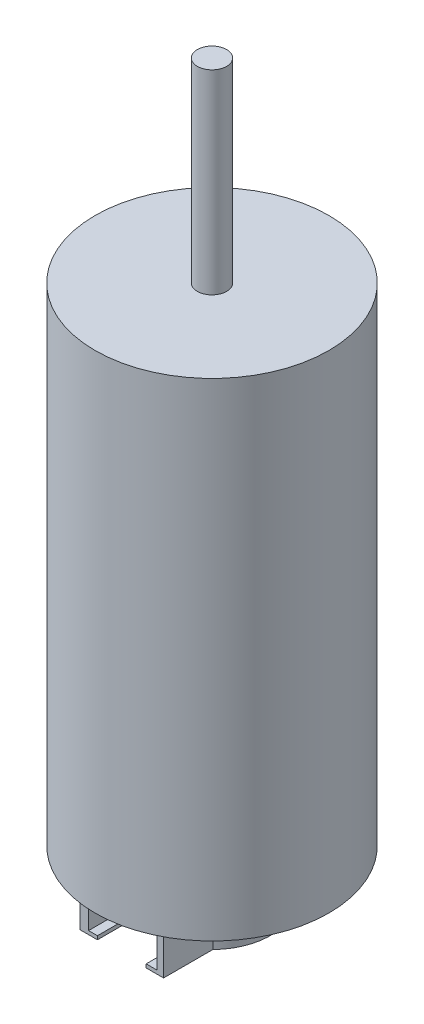
from build123d import *

# Parameters (mm, degrees)
SKETCH1_R           = 12
BOSS_EXTRUDE1_DEPTH = 50
SKETCH2_R           = 1.5
BOSS_EXTRUDE2_DEPTH = 20
BOSS_EXTRUDE3_DEPTH = 5
SKETCH4_W           = 7
SKETCH4_H           = 4
CUT_EXTRUDE1_DEPTH  = 5
SKETCH5_W           = 5
SKETCH5_H           = 3.450611601
CUT_EXTRUDE2_DEPTH  = 0.4


with BuildPart() as part:
    # Sketch1 → Boss-Extrude1 (new body)
    with BuildSketch(Plane(origin=(0, 0, 0), x_dir=(1, 0, 0), z_dir=(0, 1, 0))):
        with Locations(Location((0, 0, 0), (0, 0, 270))):
            Circle(SKETCH1_R)
    extrude(amount=BOSS_EXTRUDE1_DEPTH)

    # Sketch2 → Boss-Extrude2 (add)
    with BuildSketch(Plane(origin=(0, 50, 0), x_dir=(1, 0, 0), z_dir=(0, 1, 0))):
        with Locations(Location((0, 0, 0), (0, 0, 270))):
            Circle(SKETCH2_R)
    extrude(amount=BOSS_EXTRUDE2_DEPTH)

    # Sketch3 → Boss-Extrude3 (add)
    with BuildSketch(Plane.XZ):
        with BuildLine():
            Line((-4.284272991, 4.200595784), (-4.284272991, 9.25435285))
            Line((-4.284272991, 9.25435285), (4.284272991, 9.25435285))
            Line((4.284272991, 9.25435285), (4.284272991, 4.200595784))
            ThreePointArc((4.284272991, 4.200595784), (0, -6), (-4.284272991, 4.200595784))
        make_face()
    extrude(amount=BOSS_EXTRUDE3_DEPTH)

    # Sketch4 → Cut-Extrude1 (cut)
    with BuildSketch(Plane.XY.offset(9.25435285)):
        with Locations((0.08918727, -2.633127674)):
            Rectangle(SKETCH4_W, SKETCH4_H)
    extrude(amount=-CUT_EXTRUDE1_DEPTH, mode=Mode.SUBTRACT)

    # Sketch5 → Cut-Extrude2 (cut)
    with BuildSketch(Plane.XZ.offset(5)):
        with Locations((-0.001847359, 7.52904705)):
            Rectangle(SKETCH5_W, SKETCH5_H)
    extrude(amount=-CUT_EXTRUDE2_DEPTH, mode=Mode.SUBTRACT)


solid = part.part
